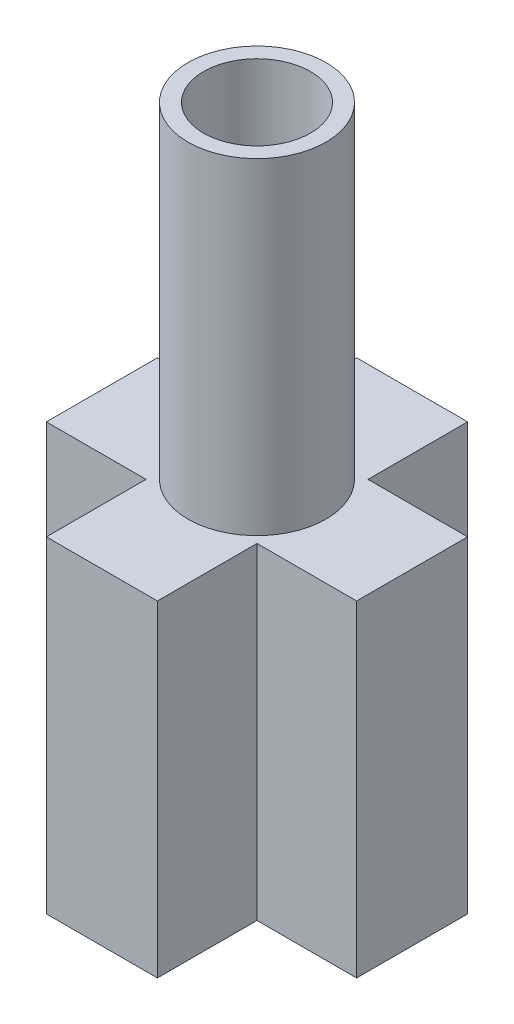
from build123d import *

# Parameters (mm, degrees)
BOSS_EXTRUDE1_DEPTH = 5.08
SKETCH2_R           = 1.073303583
SKETCH2_R_2         = 0.831378849
BOSS_EXTRUDE2_DEPTH = 5.08
CUT_EXTRUDE1_START  = -3.81
SKETCH4_R           = 0.831378849
CUT_EXTRUDE1_DEPTH  = 3.81


with BuildPart() as part:
    # Sketch1 → Boss-Extrude1 (new body)
    with BuildSketch(Plane(origin=(0, 0, 0), x_dir=(1, 0, 0), z_dir=(0, 1, 0))):
        Polygon((0.8636, 0.8636), (2.413, 0.8636), (2.413, -0.8636), (0.8636, -0.8636), (0.8636, -2.413), (-0.8636, -2.413), (-0.8636, -0.8636), (-2.413, -0.8636), (-2.413, 0.8636), (-0.8636, 0.8636), (-0.8636, 2.413), (0.8636, 2.413), align=None)
    extrude(amount=BOSS_EXTRUDE1_DEPTH)

    # Sketch2 → Boss-Extrude2 (add)
    with BuildSketch(Plane(origin=(0, 5.08, 0), x_dir=(1, 0, 0), z_dir=(0, 1, 0))):
        with Locations(Location((0, 0, 0), (0, 0, 270))):
            Circle(SKETCH2_R)
        with Locations(Location((0, 0, 0), (0, 0, 270))):
            Circle(SKETCH2_R_2, mode=Mode.SUBTRACT)
    extrude(amount=BOSS_EXTRUDE2_DEPTH)

    # Sketch4 → Cut-Extrude1 (cut)
    with BuildSketch(Plane(origin=(0, 5.08, 0), x_dir=(1, 0, 0), z_dir=(0, 1, 0)).offset(CUT_EXTRUDE1_START)):
        with Locations(Location((0, 0, 0), (0, 0, 270))):
            Circle(SKETCH4_R)
    extrude(amount=CUT_EXTRUDE1_DEPTH, mode=Mode.SUBTRACT)


solid = part.part
